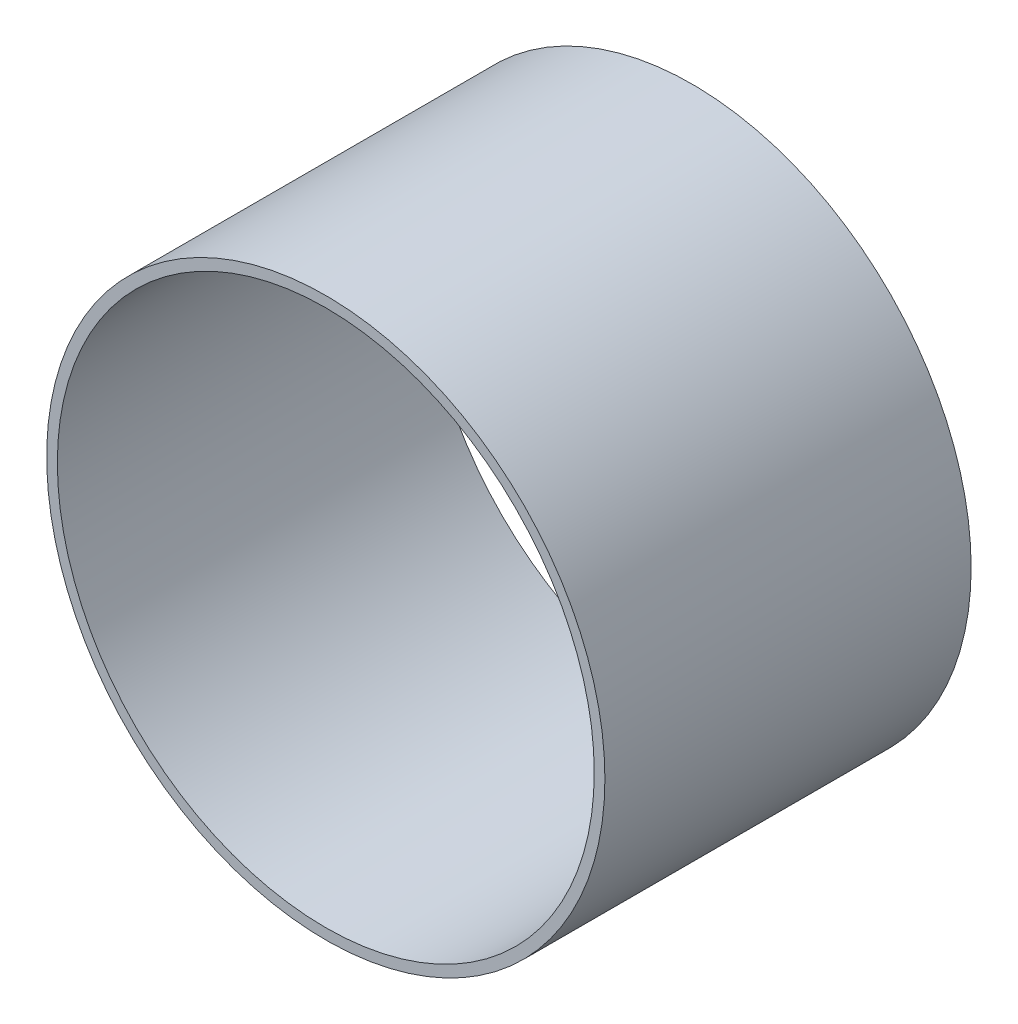
from build123d import *

# Parameters (mm, degrees)
RIM_REFERENCE_START = -44.5
SKETCH_1_R          = 78.5
SKETCH_1_R_2        = 75.5
RIM_REFERENCE_DEPTH = 103


with BuildPart() as part:
    # Эскиз1 → Rim_reference (new body)
    with BuildSketch(Plane.XY.offset(RIM_REFERENCE_START)):
        Circle(SKETCH_1_R)
        Circle(SKETCH_1_R_2, mode=Mode.SUBTRACT)
    extrude(amount=RIM_REFERENCE_DEPTH)


solid = part.part
